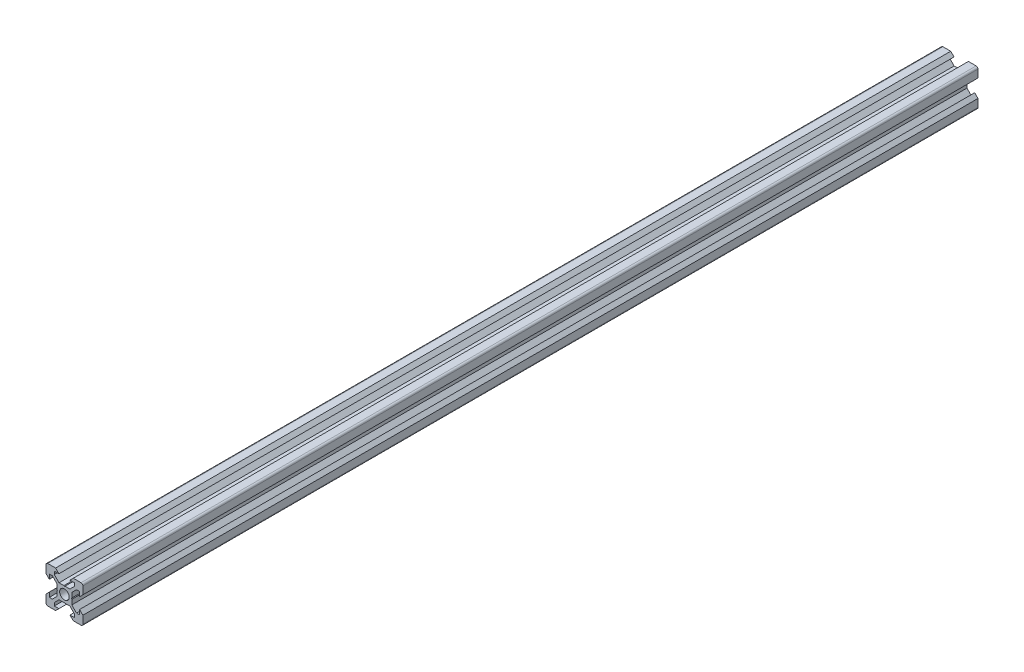
from build123d import *

# Parameters (mm, degrees)
SKETCH1_R           = 2.6
BOSS_EXTRUDE1_DEPTH = 485.7


with BuildPart() as part:
    # Sketch1 → Boss-Extrude1 (new body)
    with BuildSketch(Plane.XY):
        with BuildLine():
            Line((10.336788111, -8.113366567), (10.336788111, -3.913366567))
            Line((10.336788111, -3.913366567), (8.536788111, -2.113366567))
            Line((8.536788111, -2.113366567), (8.536788111, -4.613366567))
            Line((8.536788111, -4.613366567), (6.897448282, -4.613366567))
            Line((6.897448282, -4.613366567), (4.336788111, -2.052706395))
            Line((4.336788111, -2.052706395), (4.336788111, 0.586633433))
            Line((4.336788111, 0.586633433), (4.036788111, 0.886633433))
            Line((4.036788111, 0.886633433), (4.336788111, 1.186633433))
            Line((4.336788111, 1.186633433), (4.336788111, 3.825973261))
            Line((4.336788111, 3.825973261), (6.897448282, 6.386633433))
            Line((6.897448282, 6.386633433), (8.536788111, 6.386633433))
            Line((8.536788111, 6.386633433), (8.536788111, 3.886633433))
            Line((8.536788111, 3.886633433), (10.336788111, 5.686633433))
            Line((10.336788111, 5.686633433), (10.336788111, 9.886633433))
            ThreePointArc((10.336788111, 9.886633433), (10.043894892, 10.593740214), (9.336788111, 10.886633433))
            Line((9.336788111, 10.886633433), (5.136788111, 10.886633433))
            Line((5.136788111, 10.886633433), (3.336788111, 9.086633433))
            Line((3.336788111, 9.086633433), (5.836788111, 9.086633433))
            Line((5.836788111, 9.086633433), (5.836788111, 7.447293605))
            Line((5.836788111, 7.447293605), (3.276127939, 4.886633433))
            Line((3.276127939, 4.886633433), (0.636788111, 4.886633433))
            Line((0.636788111, 4.886633433), (0.336788111, 4.586633433))
            Line((0.336788111, 4.586633433), (0.036788111, 4.886633433))
            Line((0.036788111, 4.886633433), (-2.602551718, 4.886633433))
            Line((-2.602551718, 4.886633433), (-5.163211889, 7.447293605))
            Line((-5.163211889, 7.447293605), (-5.163211889, 9.086633433))
            Line((-5.163211889, 9.086633433), (-2.663211889, 9.086633433))
            Line((-2.663211889, 9.086633433), (-4.463211889, 10.886633433))
            Line((-4.463211889, 10.886633433), (-8.663211889, 10.886633433))
            ThreePointArc((-8.663211889, 10.886633433), (-9.370318671, 10.593740214), (-9.663211889, 9.886633433))
            Line((-9.663211889, 9.886633433), (-9.663211889, 5.686633433))
            Line((-9.663211889, 5.686633433), (-7.863211889, 3.886633433))
            Line((-7.863211889, 3.886633433), (-7.863211889, 6.386633433))
            Line((-7.863211889, 6.386633433), (-6.223872061, 6.386633433))
            Line((-6.223872061, 6.386633433), (-3.663211889, 3.825973261))
            Line((-3.663211889, 3.825973261), (-3.663211889, 1.186633433))
            Line((-3.663211889, 1.186633433), (-3.363211889, 0.886633433))
            Line((-3.363211889, 0.886633433), (-3.663211889, 0.586633433))
            Line((-3.663211889, 0.586633433), (-3.663211889, -2.052706395))
            Line((-3.663211889, -2.052706395), (-6.223872061, -4.613366567))
            Line((-6.223872061, -4.613366567), (-7.863211889, -4.613366567))
            Line((-7.863211889, -4.613366567), (-7.863211889, -2.113366567))
            Line((-7.863211889, -2.113366567), (-9.663211889, -3.913366567))
            Line((-9.663211889, -3.913366567), (-9.663211889, -8.113366567))
            ThreePointArc((-9.663211889, -8.113366567), (-9.370318671, -8.820473348), (-8.663211889, -9.113366567))
            Line((-8.663211889, -9.113366567), (-4.463211889, -9.113366567))
            Line((-4.463211889, -9.113366567), (-2.663211889, -7.313366567))
            Line((-2.663211889, -7.313366567), (-5.163211889, -7.313366567))
            Line((-5.163211889, -7.313366567), (-5.163211889, -5.674026739))
            Line((-5.163211889, -5.674026739), (-2.602551718, -3.113366567))
            Line((-2.602551718, -3.113366567), (0.036788111, -3.113366567))
            Line((0.036788111, -3.113366567), (0.336788111, -2.813366567))
            Line((0.336788111, -2.813366567), (0.636788111, -3.113366567))
            Line((0.636788111, -3.113366567), (3.276127939, -3.113366567))
            Line((3.276127939, -3.113366567), (5.836788111, -5.674026739))
            Line((5.836788111, -5.674026739), (5.836788111, -7.313366567))
            Line((5.836788111, -7.313366567), (3.336788111, -7.313366567))
            Line((3.336788111, -7.313366567), (5.136788111, -9.113366567))
            Line((5.136788111, -9.113366567), (9.336788111, -9.113366567))
            ThreePointArc((9.336788111, -9.113366567), (10.043894892, -8.820473348), (10.336788111, -8.113366567))
        make_face()
        with Locations((0.336788111, 0.886633433)):
            Circle(SKETCH1_R, mode=Mode.SUBTRACT)
    extrude(amount=BOSS_EXTRUDE1_DEPTH)


solid = part.part
